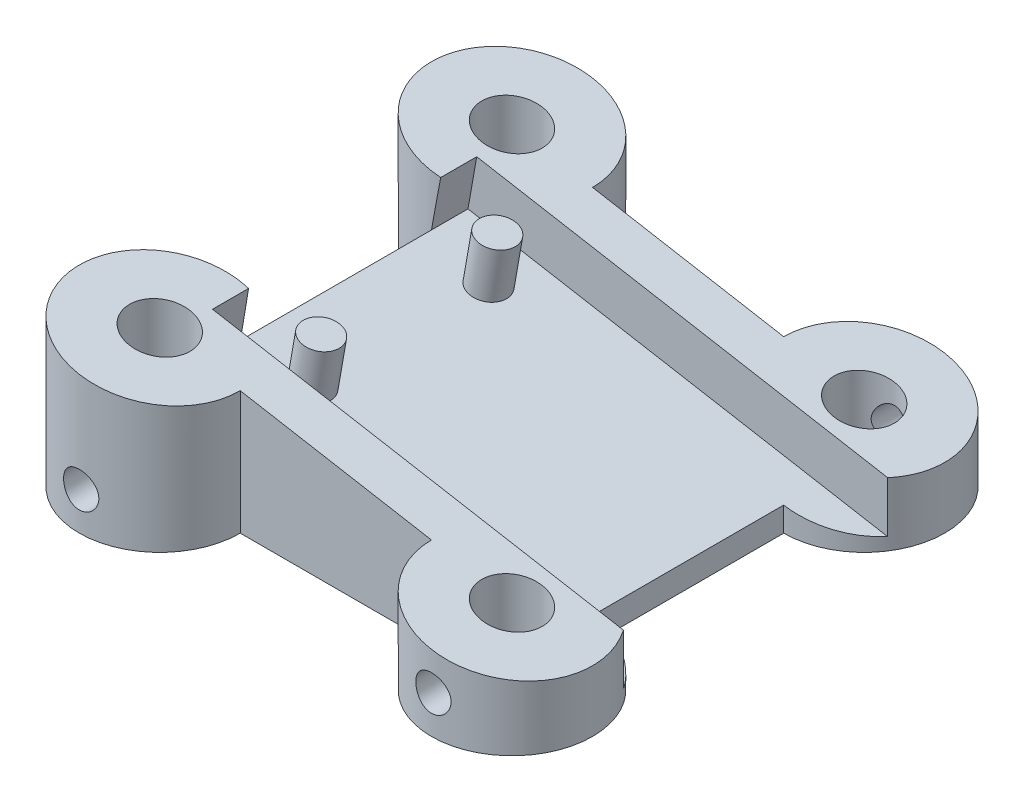
from build123d import *

# Parameters (mm, degrees)
SKETCH1_W           = 28
SKETCH1_H           = 28
BOSS_EXTRUDE1_DEPTH = 10.93715546
CUT_EXTRUDE1_DEPTH  = 42.080669049
SKETCH3_W           = 50
SKETCH3_H           = 21
CUT_EXTRUDE2_DEPTH  = 4
SKETCH11_R          = 1.45
BOSS_EXTRUDE2_DEPTH = 4
SKETCH13_R          = 2.4
CUT_EXTRUDE5_DEPTH  = 42.080669049
BOSS_EXTRUDE3_REACH = 43.081
SKETCH14_R          = 6.4
SKETCH14_R_2        = 2.4
SKETCH15_R          = 1.4
CUT_EXTRUDE6_DEPTH  = 51.122847734
SKETCH16_R          = 1.4
CUT_EXTRUDE7_DEPTH  = 51.122847895
SKETCH18_W          = 30
SKETCH18_H          = 21
CUT_EXTRUDE8_DEPTH  = 4


with BuildPart() as part:
    # Sketch1 → Boss-Extrude1 (new body)
    with BuildSketch(Plane(origin=(0, 0, 0), x_dir=(1, 0, 0), z_dir=(0, 1, 0))):
        with Locations((14, 14)):
            Rectangle(SKETCH1_W, SKETCH1_H)
    extrude(amount=BOSS_EXTRUDE1_DEPTH)

    # Sketch2 → Cut-Extrude1 (cut, through all)
    with BuildSketch(Plane.XY):
        Polygon((0, 10.93715546), (28, 6), (28, 10.93715546), align=None)
    extrude(amount=-CUT_EXTRUDE1_DEPTH, mode=Mode.SUBTRACT)

    # Sketch3 → Cut-Extrude2 (cut)
    with BuildSketch(Plane(origin=(1.870363739, 10.607359869, 0), x_dir=(0.9848077530122081, -0.1736481776669303, 0), z_dir=(0.1736481776669303, 0.9848077530122081, 0))):
        with Locations((23.100782886, 14)):
            Rectangle(SKETCH3_W, SKETCH3_H)
    extrude(amount=-CUT_EXTRUDE2_DEPTH, mode=Mode.SUBTRACT)

    # Sketch11 → Boss-Extrude2 (add)
    with BuildSketch(Plane(origin=(1.175771028, 6.668128857, 0), x_dir=(0.9848077530122081, -0.1736481776669303, 0), z_dir=(0.17364817766693028, 0.984807753012208, 0))):
        with Locations((4.022063375, 21)):
            Circle(SKETCH11_R)
        with Locations((4.022063375, 7)):
            Circle(SKETCH11_R)
    extrude(amount=BOSS_EXTRUDE2_DEPTH)

    # Sketch13 → Cut-Extrude5 (cut, through all)
    with BuildSketch(Plane.XZ):
        Circle(SKETCH13_R)
        with Locations((28, 0)):
            Circle(SKETCH13_R)
        with Locations((28, -28)):
            Circle(SKETCH13_R)
        with Locations((0, -28)):
            Circle(SKETCH13_R)
    extrude(amount=-CUT_EXTRUDE5_DEPTH, mode=Mode.SUBTRACT)

    # Boss-Extrude3: up to this plane
    boss_extrude3_end = Plane(origin=(0, 10.93715546, -28), z_dir=(-0.17364817766693036, -0.9848077530122081, 0))
    # Sketch14 → Boss-Extrude3 (add, up to the surface)
    with BuildSketch(Plane.XZ, mode=Mode.PRIVATE) as boss_extrude3_sk1:
        Circle(SKETCH14_R)
        with Locations(Location((0, 0, 0), (0, 0, 270))):
            Circle(SKETCH14_R_2, mode=Mode.SUBTRACT)
    boss_extrude3_tool1 = split(extrude(boss_extrude3_sk1.sketch, amount=-BOSS_EXTRUDE3_REACH, mode=Mode.PRIVATE), bisect_by=boss_extrude3_end, keep=Keep.BOTH, mode=Mode.PRIVATE)
    add(boss_extrude3_tool1.solids().sort_by_distance((-6.218981, 0, 0))[0])
    # Sketch14 → Boss-Extrude3 (add, up to the surface)
    with BuildSketch(Plane.XZ, mode=Mode.PRIVATE) as boss_extrude3_sk2:
        with Locations((28, 0)):
            Circle(SKETCH14_R)
        with Locations(Location((28, 0, 0), (0, 0, 270))):
            Circle(SKETCH14_R_2, mode=Mode.SUBTRACT)
    boss_extrude3_tool2 = split(extrude(boss_extrude3_sk2.sketch, amount=-BOSS_EXTRUDE3_REACH, mode=Mode.PRIVATE), bisect_by=boss_extrude3_end, keep=Keep.BOTH, mode=Mode.PRIVATE)
    add(boss_extrude3_tool2.solids().sort_by_distance((21.781019, 0, 0))[0])
    # Sketch14 → Boss-Extrude3 (add, up to the surface)
    with BuildSketch(Plane.XZ, mode=Mode.PRIVATE) as boss_extrude3_sk3:
        with Locations((28, -28)):
            Circle(SKETCH14_R)
        with Locations(Location((28, -28, 0), (0, 0, 270))):
            Circle(SKETCH14_R_2, mode=Mode.SUBTRACT)
    boss_extrude3_tool3 = split(extrude(boss_extrude3_sk3.sketch, amount=-BOSS_EXTRUDE3_REACH, mode=Mode.PRIVATE), bisect_by=boss_extrude3_end, keep=Keep.BOTH, mode=Mode.PRIVATE)
    add(boss_extrude3_tool3.solids().sort_by_distance((21.781019, 0, -28))[0])
    # Sketch14 → Boss-Extrude3 (add, up to the surface)
    with BuildSketch(Plane.XZ, mode=Mode.PRIVATE) as boss_extrude3_sk4:
        with Locations((0, -28)):
            Circle(SKETCH14_R)
        with Locations(Location((0, -28, 0), (0, 0, 270))):
            Circle(SKETCH14_R_2, mode=Mode.SUBTRACT)
    boss_extrude3_tool4 = split(extrude(boss_extrude3_sk4.sketch, amount=-BOSS_EXTRUDE3_REACH, mode=Mode.PRIVATE), bisect_by=boss_extrude3_end, keep=Keep.BOTH, mode=Mode.PRIVATE)
    add(boss_extrude3_tool4.solids().sort_by_distance((-6.218981, 0, -28))[0])

    # Sketch15 → Cut-Extrude6 (cut, through all)
    with BuildSketch(Plane(origin=(0, 0, -28), x_dir=(-1, 0, 0), z_dir=(0, 0, -1))):
        with Locations(Location((-28, 3, 0), (0, 0, 270))):
            Circle(SKETCH15_R)
        with Locations(Location((0, 3, 0), (0, 0, 90))):
            Circle(SKETCH15_R)
    extrude(amount=CUT_EXTRUDE6_DEPTH, mode=Mode.SUBTRACT)

    # Sketch16 → Cut-Extrude7 (cut, through all)
    with BuildSketch(Plane.XY):
        with Locations(Location((0, 3, 0), (0, 0, 90))):
            Circle(SKETCH16_R)
        with Locations(Location((28, 3, 0), (0, 0, 270))):
            Circle(SKETCH16_R)
    extrude(amount=CUT_EXTRUDE7_DEPTH, mode=Mode.SUBTRACT)

    # Sketch18 → Cut-Extrude8 (cut)
    with BuildSketch(Plane(origin=(1.870363739, 10.607359869, 0), x_dir=(0.9848077530122081, -0.1736481776669303, 0), z_dir=(0.1736481776669303, 0.9848077530122081, 0))):
        with BuildLine():
            Line((4.246920568, 24.5), (-1.193909192, 24.5))
            Line((-1.193909192, 24.5), (-1.193909192, 21.6))
            add(Edge.make_bspline(
                [(-1.193909192, 21.6), (2.323394895, 21.6), (4.246920568, 24.5)],
                knots=[4.71238898, 4.71238898, 4.71238898, 5.704558256, 5.704558256, 5.704558256], degree=2, weights=[1, 0.879452955, 1]))
        make_face()
        with Locations((21.091898259, 14)):
            Rectangle(SKETCH18_W, SKETCH18_H)
        with BuildLine():
            Line((-1.193909192, 6.4), (-1.193909192, 3.5))
            Line((-1.193909192, 3.5), (4.246920568, 3.5))
            add(Edge.make_bspline(
                [(4.246920568, 3.5), (2.323394895, 6.4), (-1.193909192, 6.4)],
                knots=[0.578627051, 0.578627051, 0.578627051, 1.570796327, 1.570796327, 1.570796327], degree=2, weights=[1, 0.879452955, 1]))
        make_face()
    extrude(amount=-CUT_EXTRUDE8_DEPTH, mode=Mode.SUBTRACT)


solid = part.part
